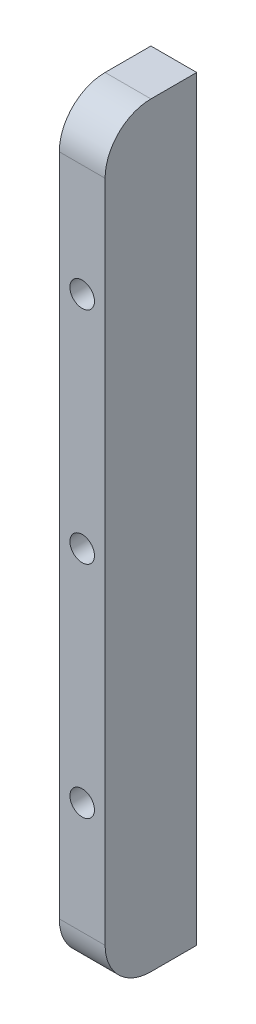
from build123d import *

# Parameters (mm, degrees)
SKETCH1_W            = 12.7
SKETCH1_H            = 104.775
BOSS_EXTRUDE1_DEPTH  = 6.35
M3_CLEARANCE_HOLE1_D = 3.4
FILLET1_R            = 6.35


with BuildPart() as part:
    # Sketch1 → Boss-Extrude1 (new body)
    with BuildSketch(Plane(origin=(0, 0, 0), x_dir=(0, 0, -1), z_dir=(1, 0, 0))):
        with Locations((-37.097368421, 4.528552632)):
            Rectangle(SKETCH1_W, SKETCH1_H)
    extrude(amount=BOSS_EXTRUDE1_DEPTH)

    # M3 Clearance Hole1 (through all)
    with Locations(Plane(origin=(0, 0, 30.747368421), x_dir=(-1, 0, 0), z_dir=(0, 0, -1))):
        with Locations((-3.175, -25.996447368), (-3.175, 4.528552632), (-3.175, 35.053552632)):
            Hole(M3_CLEARANCE_HOLE1_D / 2)

    # Fillet1
    fillet1_edges = [part.edges().sort_by_distance(p)[0] for p in [
        (3.175, -47.858947368, 43.447368421),
        (3.175, 56.916052632, 43.447368421),
    ]]
    fillet(fillet1_edges, radius=FILLET1_R)


solid = part.part
